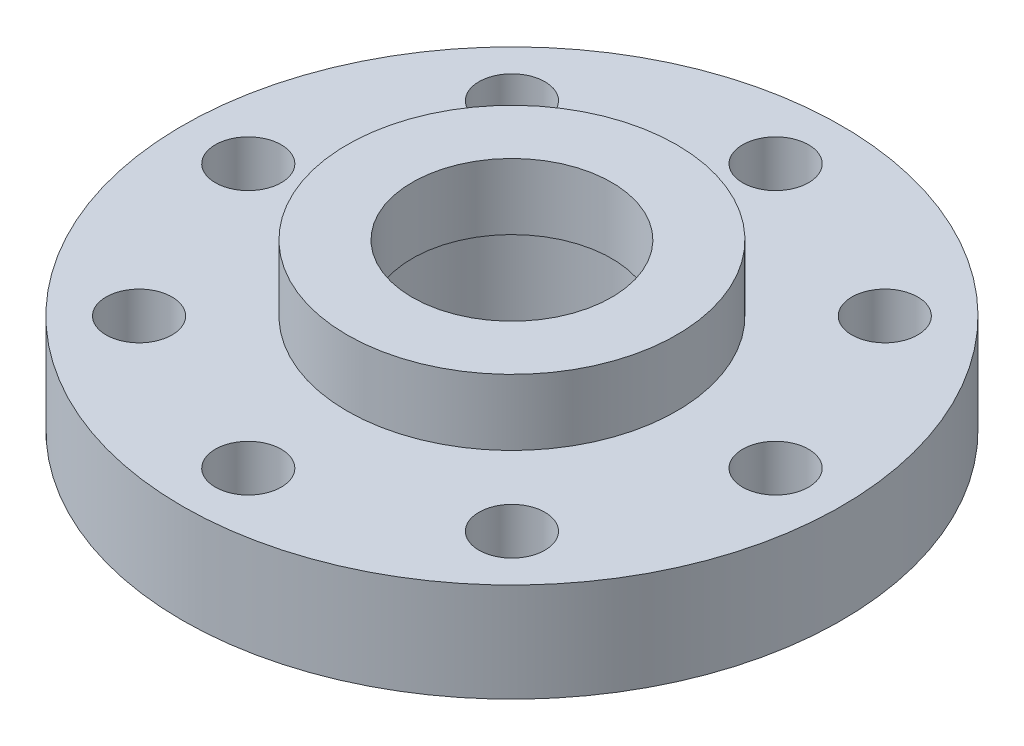
from build123d import *

# Parameters (mm, degrees)
SKETCH_1_R      = 10
SKETCH_1_R_2    = 3.26
SKETCH_1_R_3    = 1
EXTRUDE_1_DEPTH = 3
SKETCH_2_R      = 5
SKETCH_2_R_2    = 3.025
EXTRUDE_2_DEPTH = 2


with BuildPart() as part:
    # 草图1 → 凸台-拉伸1 (new body)
    with BuildSketch(Plane(origin=(0, 0, 0), x_dir=(1, 0, 0), z_dir=(0, 1, 0))):
        with Locations(Location((0, 0, 0), (0, 0, 270))):
            Circle(SKETCH_1_R)
        with Locations(Location((0, 0, 0), (0, 0, 270))):
            Circle(SKETCH_1_R_2, mode=Mode.SUBTRACT)
        with Locations(Location((0, 8, 0), (0, 0, 270))):
            Circle(SKETCH_1_R_3, mode=Mode.SUBTRACT)
        with Locations(Location((5.656854249, 5.656854249, 0), (0, 0, 270))):
            Circle(SKETCH_1_R_3, mode=Mode.SUBTRACT)
        with Locations(Location((8, 0, 0), (0, 0, 270))):
            Circle(SKETCH_1_R_3, mode=Mode.SUBTRACT)
        with Locations(Location((5.656854249, -5.656854249, 0), (0, 0, 270))):
            Circle(SKETCH_1_R_3, mode=Mode.SUBTRACT)
        with Locations(Location((0, -8, 0), (0, 0, 270))):
            Circle(SKETCH_1_R_3, mode=Mode.SUBTRACT)
        with Locations(Location((-5.656854249, -5.656854249, 0), (0, 0, 270))):
            Circle(SKETCH_1_R_3, mode=Mode.SUBTRACT)
        with Locations(Location((-8, 0, 0), (0, 0, 270))):
            Circle(SKETCH_1_R_3, mode=Mode.SUBTRACT)
        with Locations(Location((-5.656854249, 5.656854249, 0), (0, 0, 270))):
            Circle(SKETCH_1_R_3, mode=Mode.SUBTRACT)
    extrude(amount=EXTRUDE_1_DEPTH)

    # 草图2 → 凸台-拉伸2 (add)
    with BuildSketch(Plane(origin=(0, 3, 0), x_dir=(1, 0, 0), z_dir=(0, 1, 0))):
        with Locations(Location((0, 0, 0), (0, 0, 270))):
            Circle(SKETCH_2_R)
        with Locations(Location((0, 0, 0), (0, 0, 270))):
            Circle(SKETCH_2_R_2, mode=Mode.SUBTRACT)
    extrude(amount=EXTRUDE_2_DEPTH)


solid = part.part
